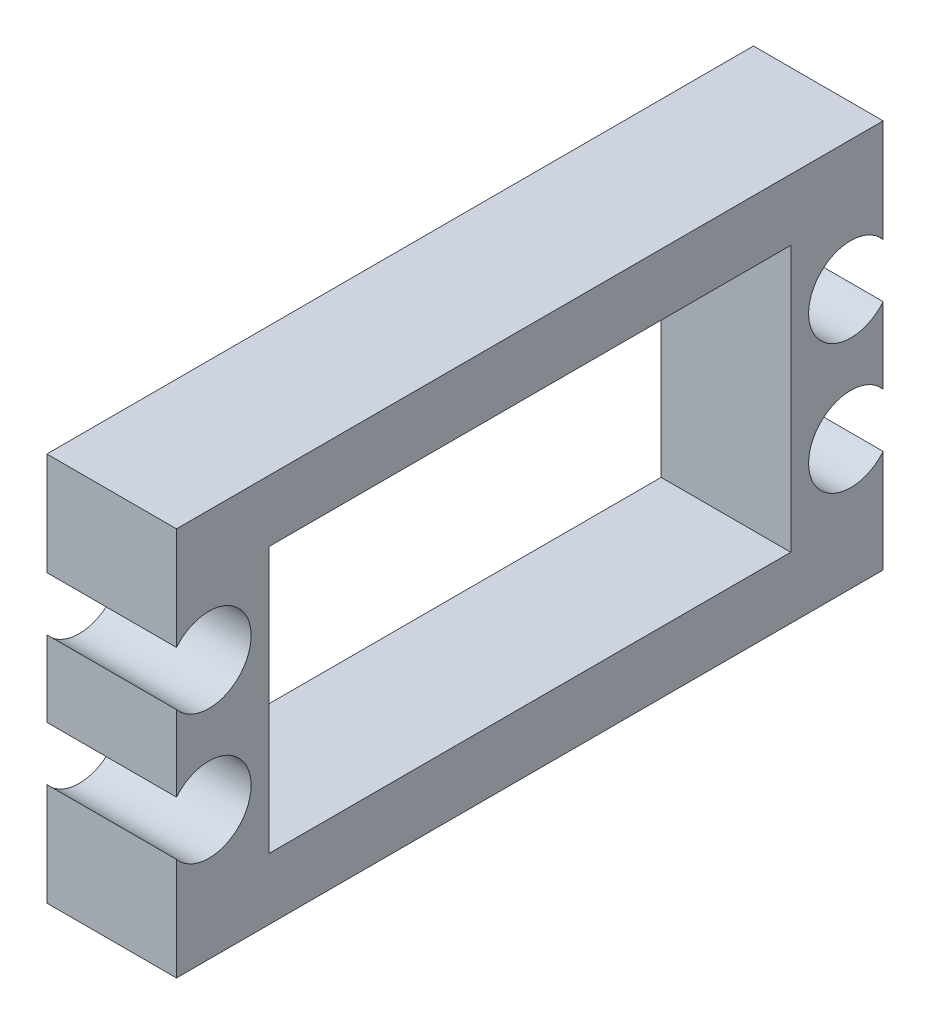
from build123d import *

# Parameters (mm, degrees)
SKETCH1_W           = 54.5
SKETCH1_H           = 30
SKETCH1_W_2         = 40.25
SKETCH1_H_2         = 20.5
BOSS_EXTRUDE1_DEPTH = 10
CUT_EXTRUDE1_DEPTH  = 20


with BuildPart() as part:
    # Sketch1 → Boss-Extrude1 (new body)
    with BuildSketch(Plane(origin=(0, 0, 0), x_dir=(0, 0, -1), z_dir=(1, 0, 0))):
        with Locations((0, 10.75)):
            Rectangle(SKETCH1_W, SKETCH1_H)
        with Locations((0, 10.75)):
            Rectangle(SKETCH1_W_2, SKETCH1_H_2, mode=Mode.SUBTRACT)
    extrude(amount=BOSS_EXTRUDE1_DEPTH)

    # Sketch3 → Cut-Extrude1 (cut)
    with BuildSketch(Plane(origin=(10, 0, 0), x_dir=(0, 0, -1), z_dir=(1, 0, 0))):
        with BuildLine():
            Line((-27.25, 17.826655966), (-27.25, 13.673344034))
            ThreePointArc((-27.25, 13.673344034), (-21.5, 15.75), (-27.25, 17.826655966))
        make_face()
        with BuildLine():
            Line((27.25, 17.826655966), (27.25, 13.673344034))
            ThreePointArc((27.25, 13.673344034), (21.5, 15.75), (27.25, 17.826655966))
        make_face()
        with BuildLine():
            Line((27.25, 3.673344034), (27.25, 7.826655966))
            ThreePointArc((27.25, 7.826655966), (21.5, 5.75), (27.25, 3.673344034))
        make_face()
        with BuildLine():
            Line((-27.25, 3.673344034), (-27.25, 7.826655966))
            ThreePointArc((-27.25, 7.826655966), (-21.5, 5.75), (-27.25, 3.673344034))
        make_face()
    extrude(amount=-CUT_EXTRUDE1_DEPTH, mode=Mode.SUBTRACT)


solid = part.part
